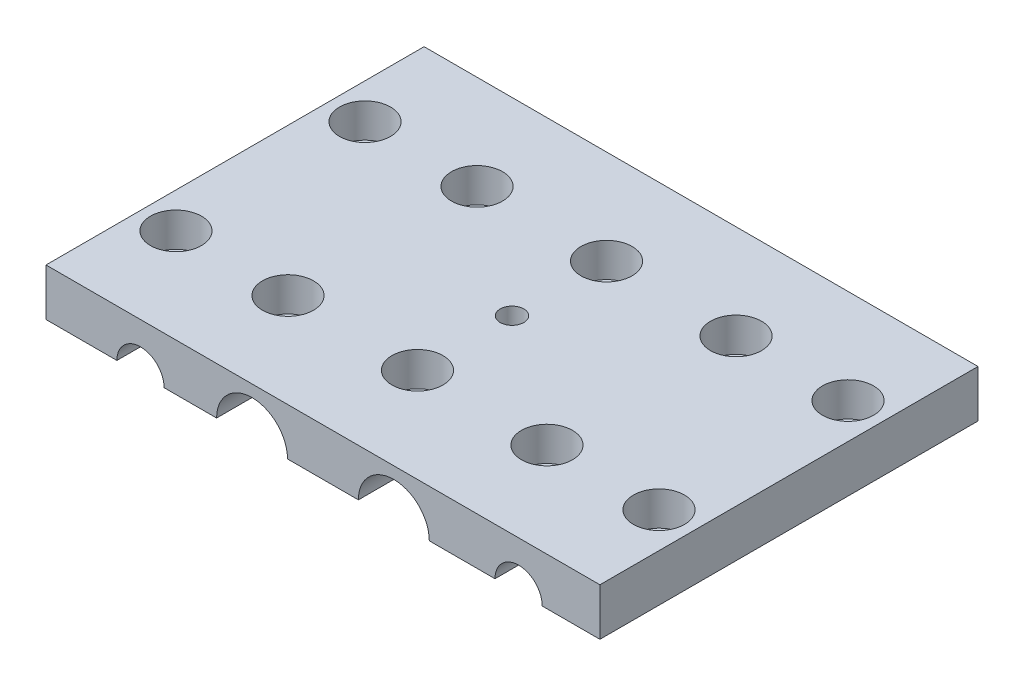
from build123d import *

# Parameters (mm, degrees)
SKETCH1_W             = 74.422
SKETCH1_H             = 50.8
BOSS_EXTRUDE1_DEPTH   = 6.35
SKETCH2_R             = 3.175
CUT_EXTRUDE1_DEPTH    = 64.289975675
SKETCH3_R             = 4.7625
CUT_EXTRUDE2_DEPTH    = 64.289975675
F_8_CLEARANCE_HOLE1_D = 4.4958
SKETCH6_R             = 3.429
CUT_EXTRUDE3_DEPTH    = 4.572
SKETCH7_R             = 1.5875
CUT_EXTRUDE4_DEPTH    = 46.498802413


with BuildPart() as part:
    # Sketch1 → Boss-Extrude1 (new body)
    with BuildSketch(Plane(origin=(0, 0, 0), x_dir=(1, 0, 0), z_dir=(0, 1, 0))):
        Rectangle(SKETCH1_W, SKETCH1_H)
    extrude(amount=BOSS_EXTRUDE1_DEPTH)

    # Sketch2 → Cut-Extrude1 (cut, through all)
    with BuildSketch(Plane.XY.offset(25.4)):
        with Locations((-24.511, 0)):
            Circle(SKETCH2_R)
        with Locations((26.289, 0)):
            Circle(SKETCH2_R)
    extrude(amount=-CUT_EXTRUDE1_DEPTH, mode=Mode.SUBTRACT)

    # Sketch3 → Cut-Extrude2 (cut, through all)
    with BuildSketch(Plane.XY.offset(25.4)):
        with Locations((-9.525, 0)):
            Circle(SKETCH3_R)
        with Locations((9.525, 0)):
            Circle(SKETCH3_R)
    extrude(amount=-CUT_EXTRUDE2_DEPTH, mode=Mode.SUBTRACT)

    # #8 Clearance Hole1 (through all)
    with Locations(Plane(origin=(0, 6.35, 0), x_dir=(1, 0, 0), z_dir=(0, 1, 0))):
        with Locations((-32.4485, 12.7), (-32.4485, -12.7), (-17.399, -12.7), (0, -12.7), (17.399, -12.7), (32.4485, -12.7), (32.4485, 12.7), (17.399, 12.7), (0, 12.7), (-17.399, 12.7)):
            Hole(F_8_CLEARANCE_HOLE1_D / 2)

    # Sketch6 → Cut-Extrude3 (cut)
    with BuildSketch(Plane(origin=(0, 6.35, 0), x_dir=(1, 0, 0), z_dir=(0, 1, 0))):
        with Locations(Location((-32.4485, 12.7, 0), (0, 0, 270))):
            Circle(SKETCH6_R)
        with Locations(Location((-17.399, 12.7, 0), (0, 0, 270))):
            Circle(SKETCH6_R)
        with Locations(Location((0, 12.7, 0), (0, 0, 270))):
            Circle(SKETCH6_R)
        with Locations(Location((17.399, 12.7, 0), (0, 0, 270))):
            Circle(SKETCH6_R)
        with Locations(Location((32.4485, 12.7, 0), (0, 0, 270))):
            Circle(SKETCH6_R)
        with Locations(Location((32.4485, -12.7, 0), (0, 0, 270))):
            Circle(SKETCH6_R)
        with Locations(Location((17.399, -12.7, 0), (0, 0, 270))):
            Circle(SKETCH6_R)
        with Locations(Location((0, -12.7, 0), (0, 0, 270))):
            Circle(SKETCH6_R)
        with Locations(Location((-17.399, -12.7, 0), (0, 0, 270))):
            Circle(SKETCH6_R)
        with Locations(Location((-32.4485, -12.7, 0), (0, 0, 270))):
            Circle(SKETCH6_R)
    extrude(amount=-CUT_EXTRUDE3_DEPTH, mode=Mode.SUBTRACT)

    # Sketch7 → Cut-Extrude4 (cut, through all)
    with BuildSketch(Plane(origin=(0, 6.35, 0), x_dir=(1, 0, 0), z_dir=(0, 1, 0))):
        with Locations(Location((0, 0, 0), (0, 0, 270))):
            Circle(SKETCH7_R)
    extrude(amount=-CUT_EXTRUDE4_DEPTH, mode=Mode.SUBTRACT)


solid = part.part
